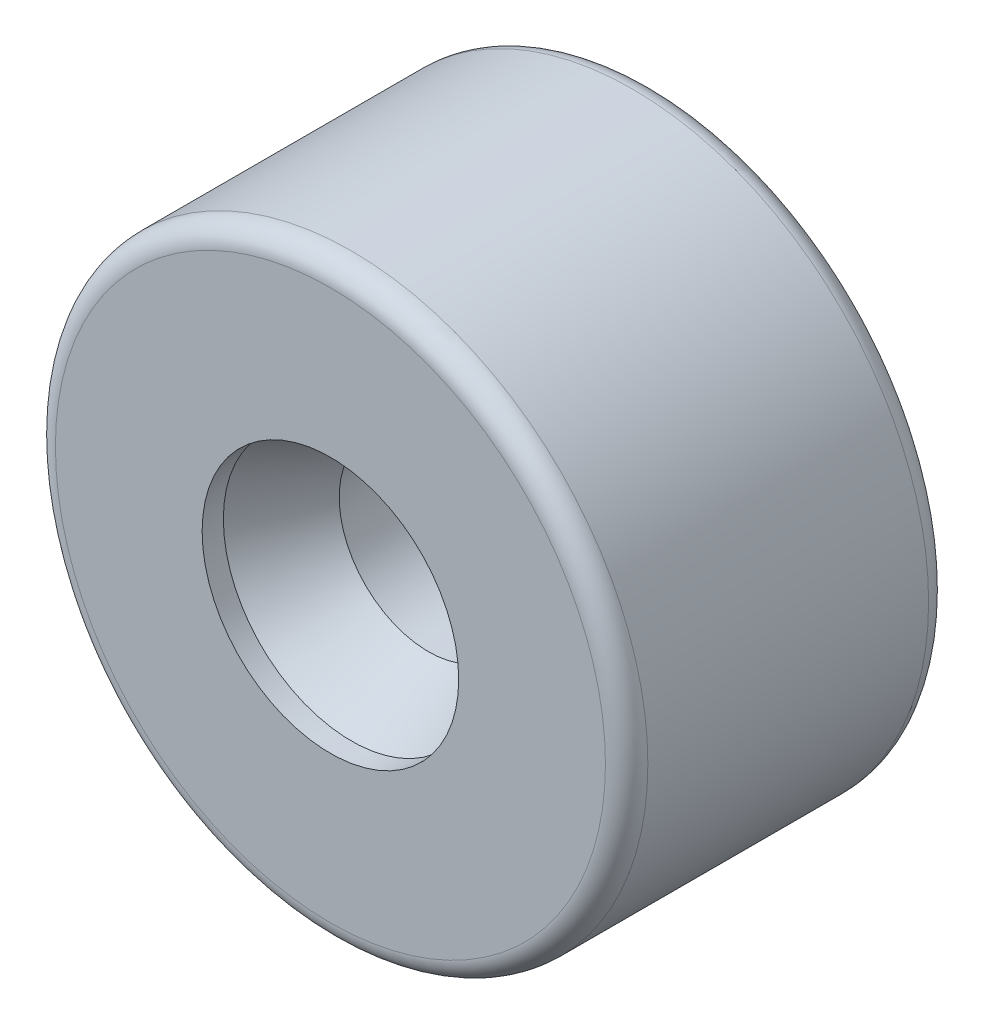
from build123d import *

# Parameters (mm, degrees)
SKETCH2_R          = 4
CUT_EXTRUDE1_DEPTH = 10


with BuildPart() as part:
    # Sketch1 → Revolve1 (revolve)
    with BuildSketch(Plane(origin=(0, 0, 0), x_dir=(0, 0, -1), z_dir=(1, 0, 0)), mode=Mode.PRIVATE) as revolve1_sk:
        Polygon((30, 45.055178728), (-30, 45.055178728), (-66.2, 63.5), (-76.2, 63.5), (-76.2, 60.5), (-66.2, 60.5), (-30, 42.055178728), (-1.5, 42.055178728), (-1.5, 10), (1.5, 10), (1.5, 42.055178728), (30, 42.055178728), (66.2, 60.5), (76.2, 60.5), (76.2, 63.5), (66.2, 63.5), align=None)
    revolve(revolve1_sk.sketch.rotate(Axis((0, 0, 361.478930537), (0, 0, -1)), 90), axis=Axis((0, 0, 361.478930537), (0, 0, -1)))

    # Sketch2 → Cut-Extrude1 (cut)
    with BuildSketch(Plane(origin=(0, 0, -1.5), x_dir=(-1, 0, 0), z_dir=(0, 0, -1))):
        with Locations((0, 30)):
            Circle(SKETCH2_R)
        with Locations((30, 0)):
            Circle(SKETCH2_R)
        with Locations((0, -30)):
            Circle(SKETCH2_R)
        with Locations((-30, 0)):
            Circle(SKETCH2_R)
    extrude(amount=-CUT_EXTRUDE1_DEPTH, mode=Mode.SUBTRACT)

    # Sketch3 → Revolve2 (revolve)
    with BuildSketch(Plane(origin=(0, 0, 0), x_dir=(0, 0, -1), z_dir=(1, 0, 0)), mode=Mode.PRIVATE) as revolve2_sk:
        with BuildLine():
            Line((-66.2, 139.7), (66.2, 139.7))
            ThreePointArc((66.2, 139.7), (73.271067812, 136.771067812), (76.2, 129.7))
            Line((76.2, 129.7), (76.2, 63.5))
            Line((76.2, 63.5), (66.2, 63.5))
            Line((66.2, 63.5), (30, 45.055178728))
            Line((30, 45.055178728), (-30, 45.055178728))
            Line((-30, 45.055178728), (-66.2, 63.5))
            Line((-66.2, 63.5), (-76.2, 63.5))
            Line((-76.2, 63.5), (-76.2, 129.7))
            ThreePointArc((-76.2, 129.7), (-73.271067812, 136.771067812), (-66.2, 139.7))
        make_face()
        with BuildLine():
            Line((-66.2, 129.7), (66.2, 129.7))
            ThreePointArc((66.2, 129.7), (67.967766953, 128.967766953), (68.7, 127.2))
            Line((68.7, 127.2), (68.7, 71))
            Line((68.7, 71), (63.893575647, 71))
            Line((63.893575647, 71), (27.946787823, 52.684196776))
            Line((27.946787823, 52.684196776), (-28.453212177, 52.684196776))
            Line((-28.453212177, 52.684196776), (-64.4, 71))
            Line((-64.4, 71), (-68.7, 71))
            Line((-68.7, 71), (-68.7, 127.2))
            ThreePointArc((-68.7, 127.2), (-67.967766953, 128.967766953), (-66.2, 129.7))
        make_face(mode=Mode.SUBTRACT)
    revolve(revolve2_sk.sketch.rotate(Axis((0, 0, 155.803154022), (0, 0, -1)), 90), axis=Axis((0, 0, 155.803154022), (0, 0, -1)))


solid = part.part
